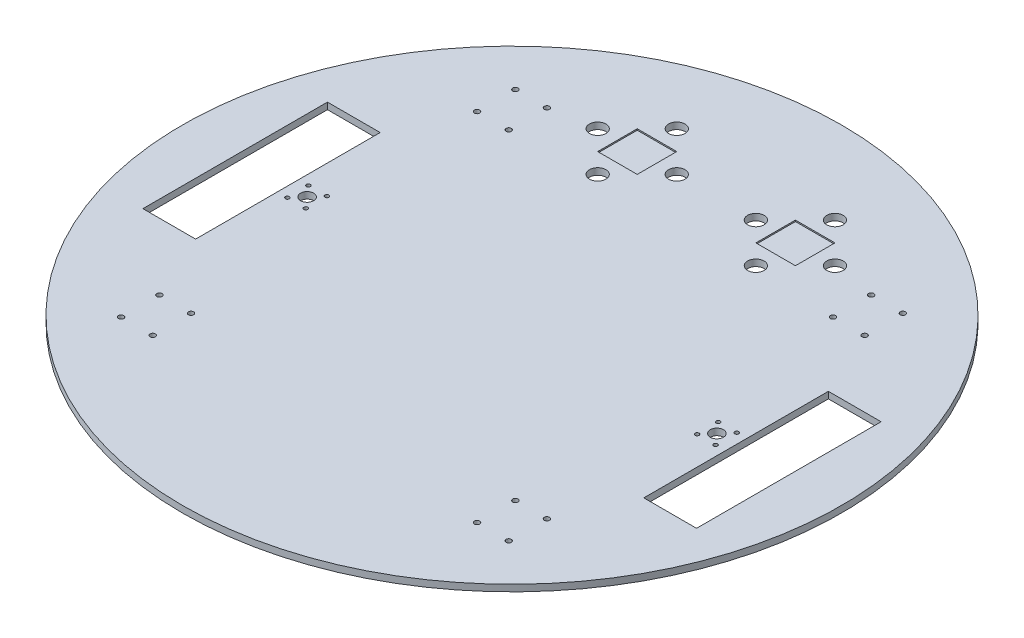
from build123d import *

# Parameters (mm, degrees)
SKETCH1_R                                 = 250
BOSS_EXTRUDE1_CICLE_BODY_DEPTH            = 5
SKETCH3_W                                 = 40
SKETCH3_H                                 = 140
CUT_DRIVE_WHEEL_DEPTH                     = 50
SKETCH5_R                                 = 1.5
SKETCH5_R_2                               = 5
CUT_DRIVE_WHEEL_FIXATION_DEPTH            = 10
SKETCH6_R                                 = 2
CUT_EXTRUDE_CASTER_WHEEEL_CUT_DEPTH       = 10
SKETCH7_R                                 = 6.25
SKETCH7_W                                 = 30
SKETCH7_H                                 = 30
CUT_EXTRUDE_EXTRUSION_FIXATION_BASE_DEPTH = 1
SKETCH9_R                                 = 6.25
CUT_EXTRUDE_1_25_BRACKET_HOLES_DEPTH      = 71


with BuildPart() as part:
    # Sketch1 → Boss-Extrude1_cicle body (new body)
    with BuildSketch(Plane(origin=(0, 0, 0), x_dir=(1, 0, 0), z_dir=(0, 1, 0))):
        with Locations(Location((0, 0, 0), (0, 0, 270))):
            Circle(SKETCH1_R)
    extrude(amount=BOSS_EXTRUDE1_CICLE_BODY_DEPTH)

    # Sketch3 → Cut-drive wheel (cut, symmetric)
    with BuildSketch(Plane(origin=(0, 0, 0), x_dir=(1, 0, 0), z_dir=(0, 1, 0))):
        with Locations((-190, 0)):
            Rectangle(SKETCH3_W, SKETCH3_H)
        with Locations((190, 0)):
            Rectangle(SKETCH3_W, SKETCH3_H)
    extrude(amount=CUT_DRIVE_WHEEL_DEPTH, both=True, mode=Mode.SUBTRACT)

    # Sketch5 → Cut- drive wheel_fixation (cut)
    with BuildSketch(Plane(origin=(0, 5, 0), x_dir=(1, 0, 0), z_dir=(0, 1, 0))):
        with Locations(Location((-162.40625, -8, 0), (0, 0, 270))):
            Circle(SKETCH5_R)
        with Locations(Location((-148.40625, 8, 0), (0, 0, 270))):
            Circle(SKETCH5_R)
        with Locations(Location((-155.40625, 0, 0), (0, 0, 270))):
            Circle(SKETCH5_R_2)
        with Locations(Location((-148.40625, -8, 0), (0, 0, 270))):
            Circle(SKETCH5_R)
        with Locations(Location((-162.40625, 8, 0), (0, 0, 270))):
            Circle(SKETCH5_R)
    cut_drive_wheel_fixation = extrude(amount=-CUT_DRIVE_WHEEL_FIXATION_DEPTH, mode=Mode.SUBTRACT)

    # Mirror-drive wheel: Cut- drive wheel_fixation across plane
    add(cut_drive_wheel_fixation.mirror(Plane(origin=(0, 0, 0), x_dir=(0, 0, 1), z_dir=(1, 0, 0))), mode=Mode.SUBTRACT)

    # Sketch6 → Cut-Extrude_caster_wheeel_cut (cut)
    with BuildSketch(Plane(origin=(0, 5, 0), x_dir=(1, 0, 0), z_dir=(0, 1, 0))):
        with Locations(Location((-123, 149.5, 0), (0, 0, 270))):
            Circle(SKETCH6_R)
        with Locations(Location((-147, 149.5, 0), (0, 0, 270))):
            Circle(SKETCH6_R)
        with Locations(Location((-147, 120.5, 0), (0, 0, 270))):
            Circle(SKETCH6_R)
        with Locations(Location((-123, 120.5, 0), (0, 0, 270))):
            Circle(SKETCH6_R)
        with Locations(Location((123, 149.5, 0), (0, 0, 270))):
            Circle(SKETCH6_R)
        with Locations(Location((147, 149.5, 0), (0, 0, 270))):
            Circle(SKETCH6_R)
        with Locations(Location((147, 120.5, 0), (0, 0, 270))):
            Circle(SKETCH6_R)
        with Locations(Location((123, 120.5, 0), (0, 0, 270))):
            Circle(SKETCH6_R)
        with Locations(Location((123, -149.5, 0), (0, 0, 270))):
            Circle(SKETCH6_R)
        with Locations(Location((123, -120.5, 0), (0, 0, 270))):
            Circle(SKETCH6_R)
        with Locations(Location((147, -149.5, 0), (0, 0, 270))):
            Circle(SKETCH6_R)
        with Locations(Location((147, -120.5, 0), (0, 0, 270))):
            Circle(SKETCH6_R)
        with Locations(Location((-123, -120.5, 0), (0, 0, 270))):
            Circle(SKETCH6_R)
        with Locations(Location((-147, -120.5, 0), (0, 0, 270))):
            Circle(SKETCH6_R)
        with Locations(Location((-147, -149.5, 0), (0, 0, 270))):
            Circle(SKETCH6_R)
        with Locations(Location((-123, -149.5, 0), (0, 0, 270))):
            Circle(SKETCH6_R)
    extrude(amount=-CUT_EXTRUDE_CASTER_WHEEEL_CUT_DEPTH, mode=Mode.SUBTRACT)

    # Sketch7 → Cut-Extrude__extrusion_fixation_base (cut)
    with BuildSketch(Plane(origin=(0, 5, 0), x_dir=(1, 0, 0), z_dir=(0, 1, 0))):
        with Locations(Location((-90, 155, 0), (0, 0, 270))):
            Circle(SKETCH7_R)
        with Locations(Location((-60, 185, 0), (0, 0, 270))):
            Circle(SKETCH7_R)
        with Locations(Location((-30, 155, 0), (0, 0, 270))):
            Circle(SKETCH7_R)
        with Locations(Location((-60, 125, 0), (0, 0, 270))):
            Circle(SKETCH7_R)
        with Locations(Location((90, 155, 0), (0, 0, 90))):
            Circle(SKETCH7_R)
        with Locations(Location((60, 125, 0), (0, 0, 90))):
            Circle(SKETCH7_R)
        with Locations(Location((30, 155, 0), (0, 0, 90))):
            Circle(SKETCH7_R)
        with Locations(Location((60, 185, 0), (0, 0, 90))):
            Circle(SKETCH7_R)
        with Locations((60, 155)):
            Rectangle(SKETCH7_W, SKETCH7_H)
        with Locations((-60, 155)):
            Rectangle(SKETCH7_W, SKETCH7_H)
    extrude(amount=-CUT_EXTRUDE_EXTRUSION_FIXATION_BASE_DEPTH, mode=Mode.SUBTRACT)

    # Sketch9 → Cut-Extrude_1.25 bracket holes (cut)
    with BuildSketch(Plane(origin=(0, 4, 0), x_dir=(1, 0, 0), z_dir=(0, 1, 0))):
        with Locations(Location((-60, 185, 0), (0, 0, 270))):
            Circle(SKETCH9_R)
        with Locations(Location((-30, 155, 0), (0, 0, 270))):
            Circle(SKETCH9_R)
        with Locations(Location((-90, 155, 0), (0, 0, 270))):
            Circle(SKETCH9_R)
        with Locations(Location((-60, 125, 0), (0, 0, 270))):
            Circle(SKETCH9_R)
        with Locations(Location((60, 185, 0), (0, 0, 270))):
            Circle(SKETCH9_R)
        with Locations(Location((30, 155, 0), (0, 0, 270))):
            Circle(SKETCH9_R)
        with Locations(Location((60, 125, 0), (0, 0, 270))):
            Circle(SKETCH9_R)
        with Locations(Location((90, 155, 0), (0, 0, 270))):
            Circle(SKETCH9_R)
    extrude(amount=-CUT_EXTRUDE_1_25_BRACKET_HOLES_DEPTH, mode=Mode.SUBTRACT)


solid = part.part
